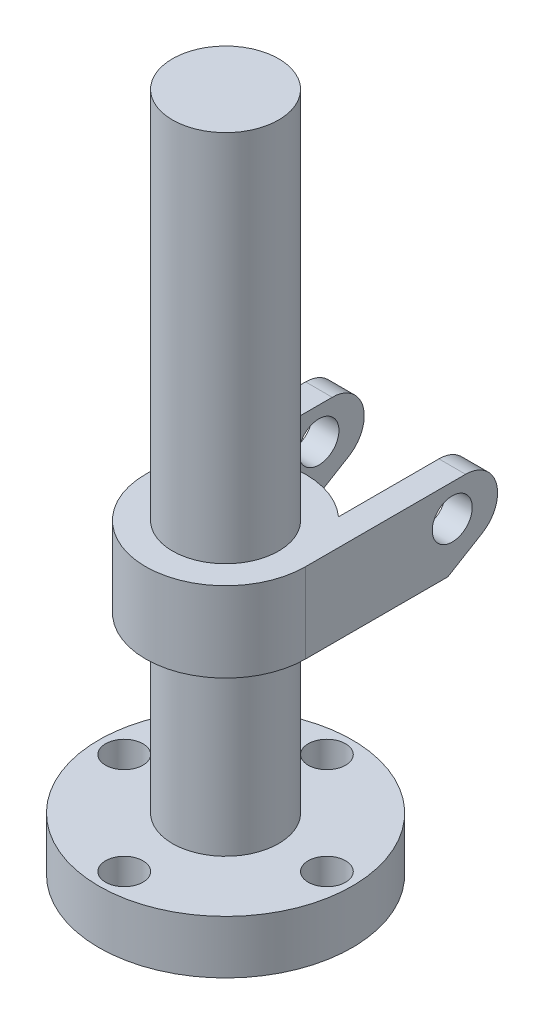
from build123d import *

# Parameters (mm, degrees)
SKETCH1_R           = 47.5
BOSS_EXTRUDE1_DEPTH = 20
SKETCH2_R           = 19.9
BOSS_EXTRUDE2_DEPTH = 65
SKETCH3_R           = 30
BOSS_EXTRUDE3_DEPTH = 30
SKETCH4_R           = 19.9
BOSS_EXTRUDE4_DEPTH = 140
SKETCH5_R           = 7.5
BOSS_EXTRUDE5_DEPTH = 10
SKETCH6_R           = 7
CUT_EXTRUDE1_DEPTH  = 10
SKETCH7_R           = 5
CUT_EXTRUDE2_DEPTH  = 23
SKETCH8_R           = 20
CUT_EXTRUDE3_DEPTH  = 15


with BuildPart() as part:
    # Sketch1 → Boss-Extrude1 (new body)
    with BuildSketch(Plane(origin=(0, 0, 0), x_dir=(1, 0, 0), z_dir=(0, 1, 0))):
        with Locations(Location((0, 0, 0), (0, 0, 270))):
            Circle(SKETCH1_R)
    extrude(amount=BOSS_EXTRUDE1_DEPTH)

    # Sketch2 → Boss-Extrude2 (add)
    with BuildSketch(Plane(origin=(0, 20, 0), x_dir=(1, 0, 0), z_dir=(0, 1, 0))):
        with Locations(Location((0, 0, 0), (0, 0, 270))):
            Circle(SKETCH2_R)
    extrude(amount=BOSS_EXTRUDE2_DEPTH)

    # Sketch3 → Boss-Extrude3 (add)
    with BuildSketch(Plane(origin=(0, 85, 0), x_dir=(1, 0, 0), z_dir=(0, 1, 0))):
        with Locations(Location((0, 0, 0), (0, 0, 270))):
            Circle(SKETCH3_R)
    extrude(amount=BOSS_EXTRUDE3_DEPTH)

    # Sketch4 → Boss-Extrude4 (add)
    with BuildSketch(Plane(origin=(0, 115, 0), x_dir=(1, 0, 0), z_dir=(0, 1, 0))):
        with Locations(Location((0, 0, 0), (0, 0, 270))):
            Circle(SKETCH4_R)
    extrude(amount=BOSS_EXTRUDE4_DEPTH)

    # Sketch5 → Boss-Extrude5 (add)
    with BuildSketch(Plane(origin=(30, 0, 0), x_dir=(0, 0, -1), z_dir=(1, 0, 0))):
        with BuildLine():
            Line((0, 115), (55, 115))
            Line((55, 115), (60, 115))
            ThreePointArc((60, 115), (71.563565439, 106.206860513), (66.180456899, 92.713992392))
            Line((66.180456899, 92.713992392), (53.342217635, 85))
            Line((53.342217635, 85), (0, 85))
            Line((0, 85), (0, 115))
        make_face()
        with Locations((55, 103)):
            Circle(SKETCH5_R, mode=Mode.SUBTRACT)
    boss_extrude5 = extrude(amount=-BOSS_EXTRUDE5_DEPTH)

    # Mirror1: Boss-Extrude5 across plane
    add(boss_extrude5.mirror(Plane(origin=(0, 0, 0), x_dir=(0, 0, 1), z_dir=(1, 0, 0))))

    # Sketch6 → Cut-Extrude1 (cut)
    with BuildSketch(Plane(origin=(0, 20, 0), x_dir=(1, 0, 0), z_dir=(0, 1, 0))):
        with Locations(Location((0, 38, 0), (0, 0, 270))):
            Circle(SKETCH6_R)
        with Locations(Location((38, 0, 0), (0, 0, 270))):
            Circle(SKETCH6_R)
        with Locations(Location((0, -38, 0), (0, 0, 270))):
            Circle(SKETCH6_R)
        with Locations(Location((-38, 0, 0), (0, 0, 270))):
            Circle(SKETCH6_R)
    extrude(amount=-CUT_EXTRUDE1_DEPTH, mode=Mode.SUBTRACT)

    # Sketch7 → Cut-Extrude2 (cut)
    with BuildSketch(Plane.XZ):
        with Locations(Location((0, 38, 0), (0, 0, 270))):
            Circle(SKETCH7_R)
        with Locations(Location((38, 0, 0), (0, 0, 270))):
            Circle(SKETCH7_R)
        with Locations(Location((0, -38, 0), (0, 0, 270))):
            Circle(SKETCH7_R)
        with Locations(Location((-38, 0, 0), (0, 0, 270))):
            Circle(SKETCH7_R)
    extrude(amount=-CUT_EXTRUDE2_DEPTH, mode=Mode.SUBTRACT)

    # Sketch8 → Cut-Extrude3 (cut)
    with BuildSketch(Plane.XZ):
        with Locations(Location((0, 0, 0), (0, 0, 270))):
            Circle(SKETCH8_R)
    extrude(amount=-CUT_EXTRUDE3_DEPTH, mode=Mode.SUBTRACT)


solid = part.part
